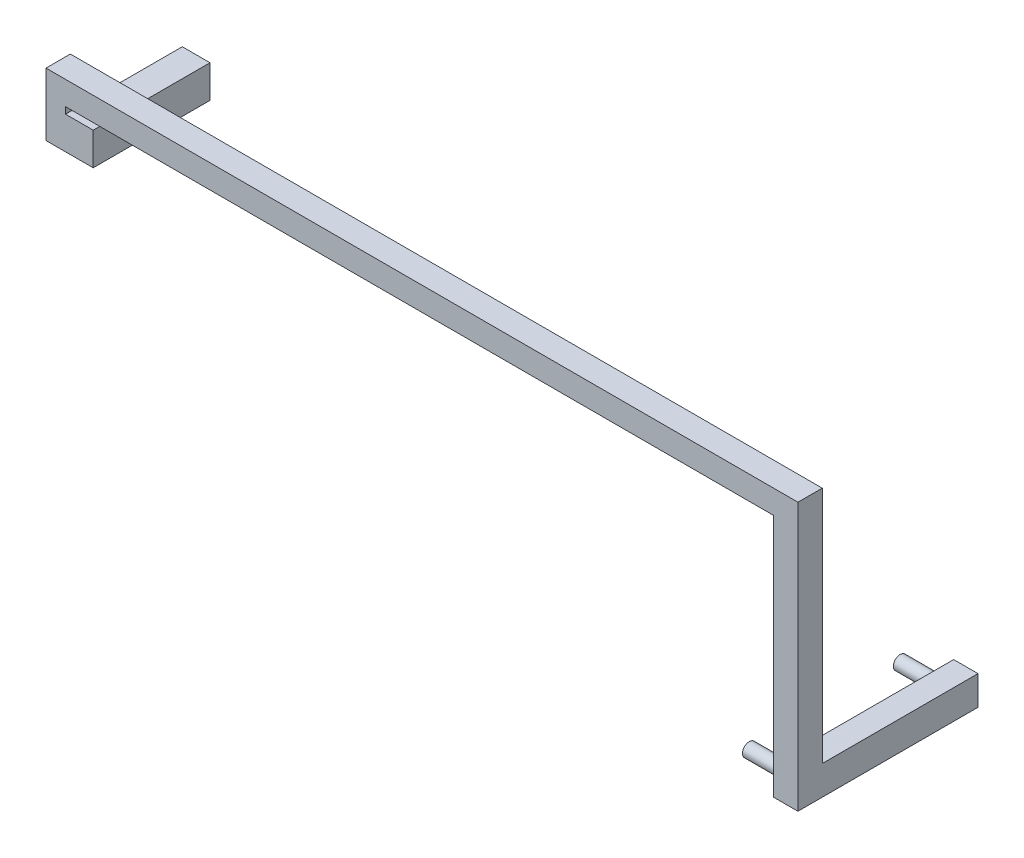
from build123d import *

# Parameters (mm, degrees)
BOSS_EXTRUDE1_DEPTH = 5
SKETCH2_W           = 5.7
SKETCH2_H           = 6.7
BOSS_EXTRUDE6_DEPTH = 24
SKETCH5_W           = 5
SKETCH5_H           = 6
BOSS_EXTRUDE7_DEPTH = 32
SKETCH4_R           = 1.4
BOSS_EXTRUDE4_DEPTH = 8


with BuildPart() as part:
    # Sketch1 → Boss-Extrude1 (new body)
    with BuildSketch(Plane.XY):
        Polygon((0, 6.7), (0, 8.05), (5.5, 8.05), (145.5, 8.05), (145.5, -42.1), (150.5, -42.1), (150.5, 8.05), (150.5, 12.9), (5.5, 12.9), (-4, 12.9), (-4, 0), (0, 0), (5.7, 0), (5.7, 6.7), align=None)
    extrude(amount=BOSS_EXTRUDE1_DEPTH)

    # Sketch2 → Boss-Extrude6 (add)
    with BuildSketch(Plane.XY.offset(5)):
        with Locations((2.85, 3.35)):
            Rectangle(SKETCH2_W, SKETCH2_H)
    extrude(amount=-BOSS_EXTRUDE6_DEPTH)

    # Sketch5 → Boss-Extrude7 (add)
    with BuildSketch(Plane(origin=(0, 0, 0), x_dir=(-1, 0, 0), z_dir=(0, 0, -1))):
        with Locations((-148, -39.1)):
            Rectangle(SKETCH5_W, SKETCH5_H)
    extrude(amount=BOSS_EXTRUDE7_DEPTH)

    # Sketch4 → Boss-Extrude4 (add)
    with BuildSketch(Plane.ZY.offset(-145.5)):
        with Locations(Location((-29, -39.1, 0), (0, 0, 180))):
            Circle(SKETCH4_R)
        with Locations(Location((2, -39.1, 0), (0, 0, 180))):
            Circle(SKETCH4_R)
    extrude(amount=BOSS_EXTRUDE4_DEPTH)


solid = part.part
